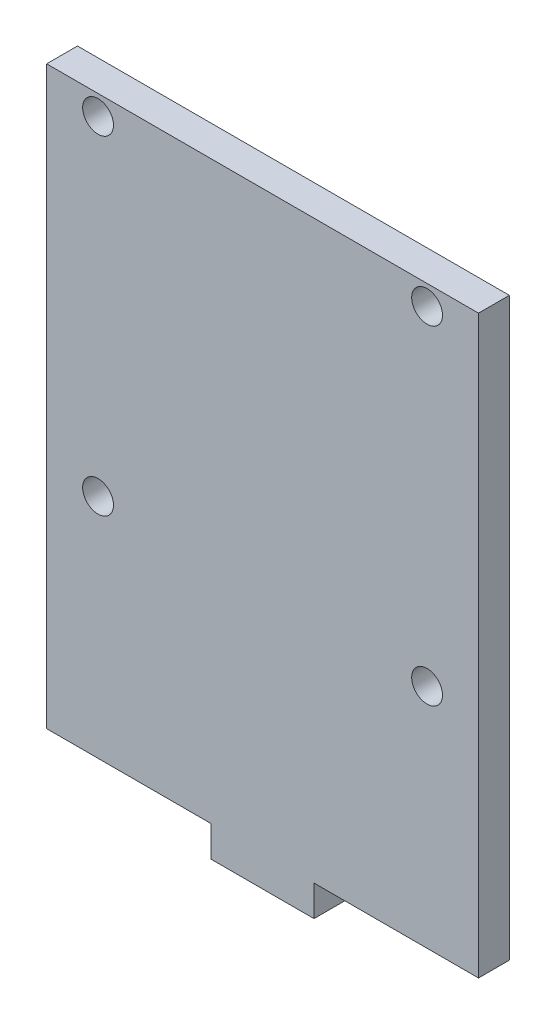
from build123d import *

# Parameters (mm, degrees)
SKETCH1_R           = 1.5
BOSS_EXTRUDE1_DEPTH = 3


with BuildPart() as part:
    # Sketch1 → Boss-Extrude1 (new body)
    with BuildSketch(Plane.XY):
        Polygon((5, -29.5), (-5, -29.5), (-5, -26.5), (-21, -26.5), (-21, 29.5), (21, 29.5), (21, -26.5), (5, -26.5), align=None)
        with Locations((-16, 27.569189012)):
            Circle(SKETCH1_R, mode=Mode.SUBTRACT)
        with Locations((-16, -4.430810988)):
            Circle(SKETCH1_R, mode=Mode.SUBTRACT)
        with Locations((16, -4.430810988)):
            Circle(SKETCH1_R, mode=Mode.SUBTRACT)
        with Locations((16, 27.569189012)):
            Circle(SKETCH1_R, mode=Mode.SUBTRACT)
    extrude(amount=BOSS_EXTRUDE1_DEPTH)


solid = part.part
